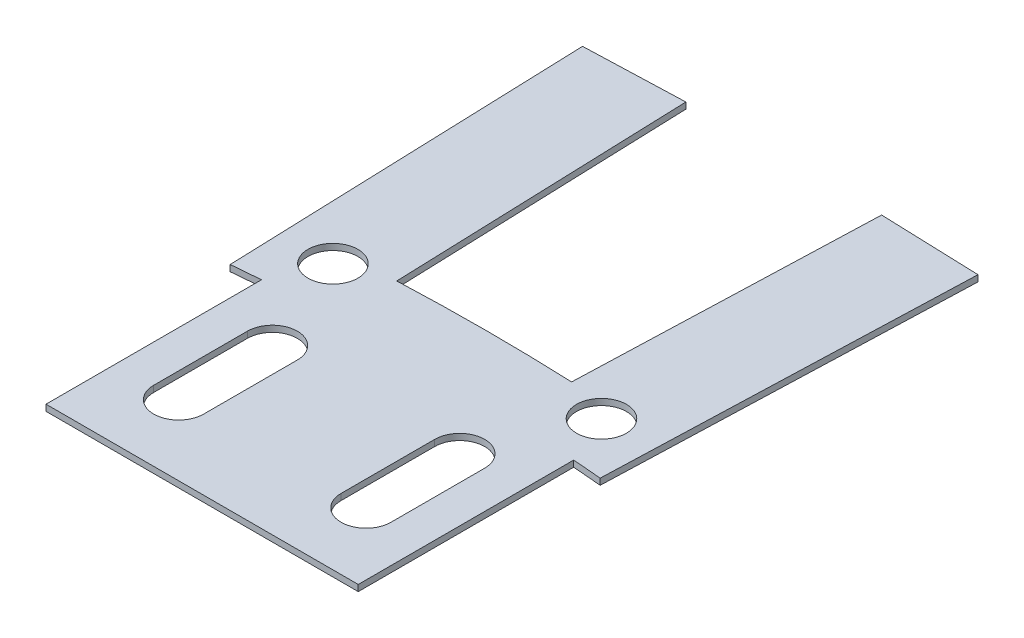
from build123d import *

# Parameters (mm, degrees)
SKETCH1_R           = 4
BOSS_EXTRUDE1_DEPTH = 0.5


with BuildPart() as part:
    # Sketch1 → Boss-Extrude1 (new, symmetric)
    with BuildSketch(Plane(origin=(0, 0, 0), x_dir=(1, 0, 0), z_dir=(0, 1, 0))):
        with BuildLine():
            Line((25, 325.804578988), (25, 291.304578988))
            Line((25, 291.304578988), (-25, 291.304578988))
            Line((-25, 291.304578988), (-25, 325.804578988))
            ThreePointArc((-25, 325.804578988), (-27.31254969, 325.618869722), (-29.623722576, 325.416746266))
            Line((-29.623722576, 325.416746266), (-29.993406947, 336.003121544))
            Line((-29.993406947, 336.003121544), (-31.665429074, 383.883570667))
            Line((-31.665429074, 383.883570667), (-15.675175842, 384.441962615))
            Line((-15.675175842, 384.441962615), (-14, 336.471202918))
            ThreePointArc((-14, 336.471202918), (0, 336.762335175), (14, 336.471202918))
            Line((14, 336.471202918), (15.675175842, 384.441962615))
            Line((15.675175842, 384.441962615), (31.665429074, 383.883570667))
            Line((31.665429074, 383.883570667), (29.993406947, 336.003121544))
            Line((29.993406947, 336.003121544), (29.623722576, 325.416746266))
            ThreePointArc((29.623722576, 325.416746266), (27.31254969, 325.618869722), (25, 325.804578988))
        make_face()
        with Locations(Location((-21.5, 333.754934474, 0), (0, 0, 270))):
            Circle(SKETCH1_R, mode=Mode.SUBTRACT)
        with Locations(Location((21.5, 333.754934474, 0), (0, 0, 90))):
            Circle(SKETCH1_R, mode=Mode.SUBTRACT)
        with BuildLine():
            Line((-19, 317.554578988), (-19, 302.554578988))
            ThreePointArc((-19, 302.554578988), (-15, 298.554578988), (-11, 302.554578988))
            Line((-11, 302.554578988), (-11, 317.554578988))
            ThreePointArc((-11, 317.554578988), (-15, 321.554578988), (-19, 317.554578988))
        make_face(mode=Mode.SUBTRACT)
        with BuildLine():
            Line((19, 317.554578988), (19, 302.554578988))
            ThreePointArc((19, 302.554578988), (15, 298.554578988), (11, 302.554578988))
            Line((11, 302.554578988), (11, 317.554578988))
            ThreePointArc((11, 317.554578988), (15, 321.554578988), (19, 317.554578988))
        make_face(mode=Mode.SUBTRACT)
    extrude(amount=BOSS_EXTRUDE1_DEPTH, both=True)


solid = part.part
